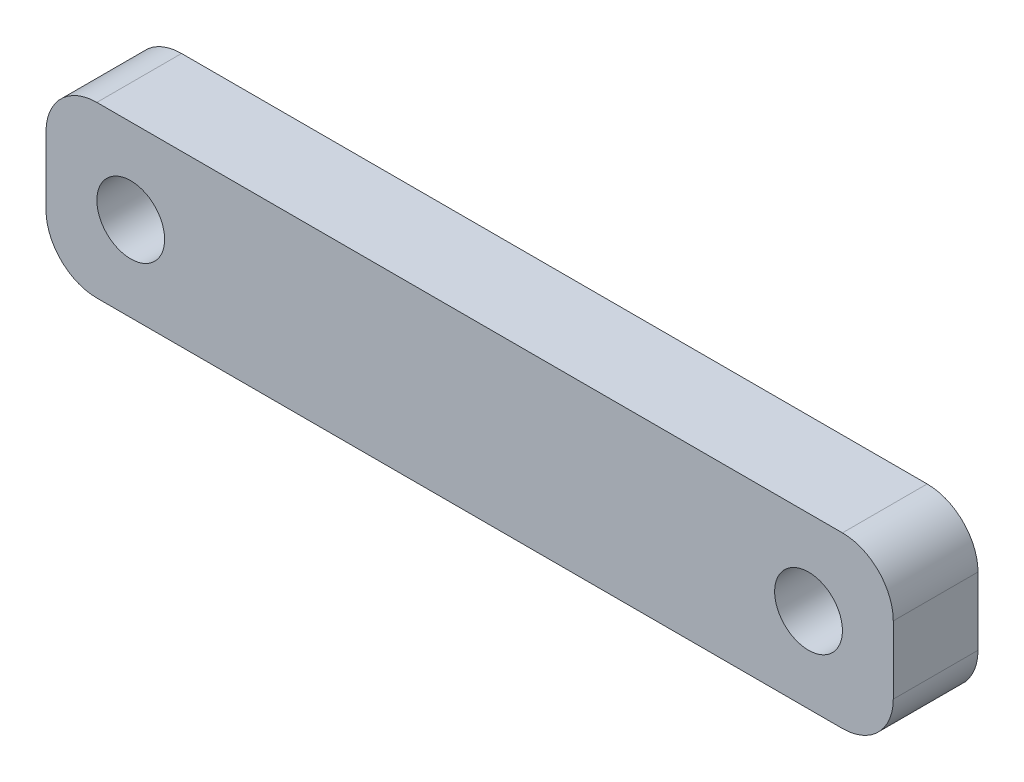
from build123d import *

# Parameters (mm, degrees)
ESQUISSE1_W        = 25
ESQUISSE1_H        = 10
ESQUISSE1_R        = 2
BOSS_EXTRU_1_DEPTH = 5
CONG_1_R           = 3
CONG_2_R           = 3
CONG_3_R           = 3
CONG_4_R           = 3


with BuildPart() as part:
    # Esquisse1 → Boss.-Extru.1 (new body)
    # profile 1 of 2: a face of its own
    with BuildSketch(Plane.XY):
        Rectangle(ESQUISSE1_W, ESQUISSE1_H)
        with Locations((-7.5, 0)):
            Circle(ESQUISSE1_R, mode=Mode.SUBTRACT)
    # profile 2 of 2: a face of its own
    with BuildSketch(Plane.XY):
        with Locations((25, 0)):
            Rectangle(ESQUISSE1_W, ESQUISSE1_H)
        with Locations((32.5, 0)):
            Circle(ESQUISSE1_R, mode=Mode.SUBTRACT)
    extrude(amount=BOSS_EXTRU_1_DEPTH)

    # Congé1
    cong_1_edges = [part.edges().sort_by_distance(p)[0] for p in [
        (37.5, 5, 2.5),
    ]]
    fillet(cong_1_edges, radius=CONG_1_R)

    # Congé2
    cong_2_edges = [part.edges().sort_by_distance(p)[0] for p in [
        (37.5, -5, 2.5),
    ]]
    fillet(cong_2_edges, radius=CONG_2_R)

    # Congé3
    cong_3_edges = [part.edges().sort_by_distance(p)[0] for p in [
        (-12.5, 5, 2.5),
    ]]
    fillet(cong_3_edges, radius=CONG_3_R)

    # Congé4
    cong_4_edges = [part.edges().sort_by_distance(p)[0] for p in [
        (-12.5, -5, 2.5),
    ]]
    fillet(cong_4_edges, radius=CONG_4_R)


solid = part.part
